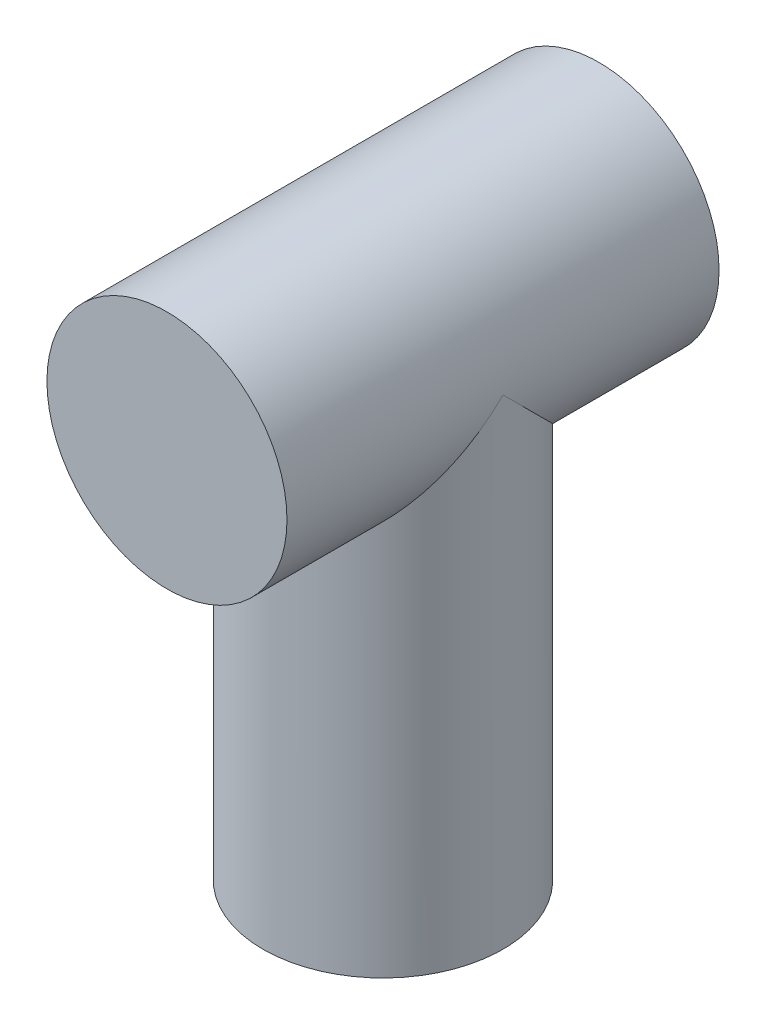
from build123d import *

# Parameters (mm, degrees)
SKETCH1_R           = 12.5
BOSS_EXTRUDE1_DEPTH = 22.5
SKETCH2_R           = 12.5
BOSS_EXTRUDE2_DEPTH = 50


with BuildPart() as part:
    # Sketch1 → Boss-Extrude1 (new, symmetric)
    with BuildSketch(Plane.XY):
        with Locations(Location((0, 0, 0), (0, 0, 180))):
            Circle(SKETCH1_R)
    extrude(amount=BOSS_EXTRUDE1_DEPTH, both=True)

    # Sketch2 → Boss-Extrude2 (add)
    with BuildSketch(Plane(origin=(0, 0, 0), x_dir=(1, 0, 0), z_dir=(0, 1, 0))):
        with Locations(Location((0, 0, 0), (0, 0, 270))):
            Circle(SKETCH2_R)
    extrude(amount=-BOSS_EXTRUDE2_DEPTH)


solid = part.part
